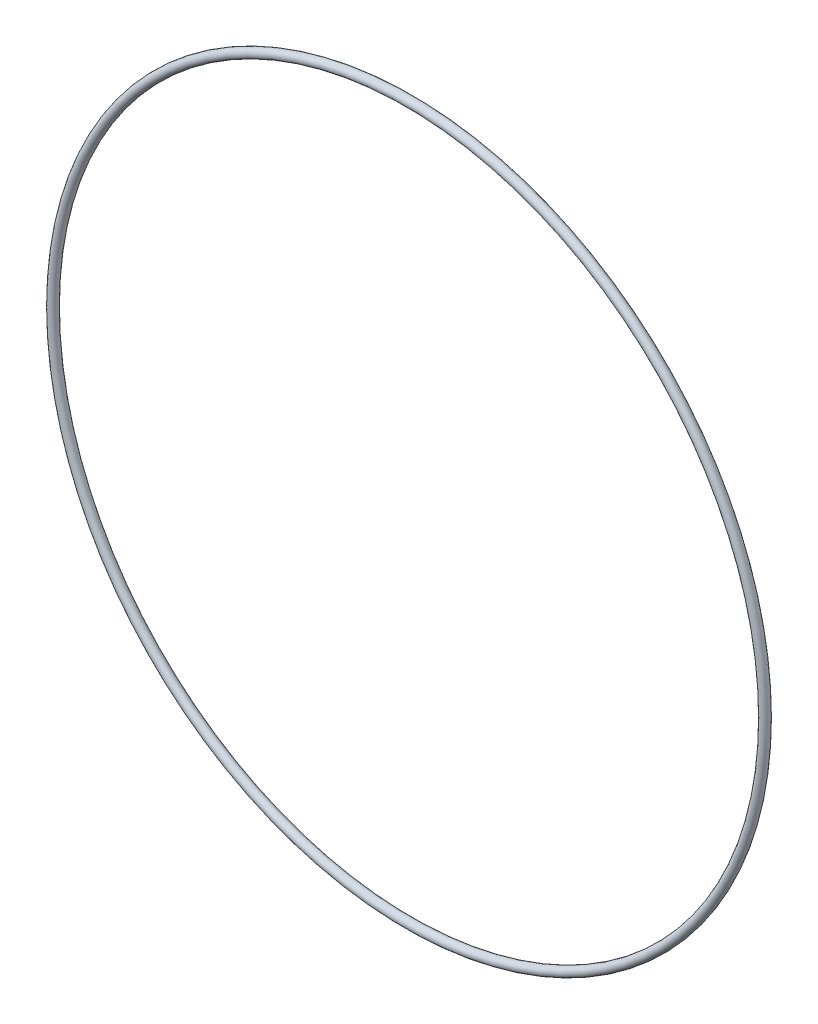
from build123d import *

# Parameters (mm, degrees)
SKETCH1_R   = 6
SKETCH1_R_2 = 5


with BuildPart() as part:
    # Sketch1 → Revolve1 (revolve)
    with BuildSketch(Plane(origin=(0, 0, 0), x_dir=(1, 0, 0), z_dir=(0, 1, 0))):
        Circle(SKETCH1_R)
        Circle(SKETCH1_R_2, mode=Mode.SUBTRACT)
    revolve(axis=Axis((470, 0, -23.804468453), (0, 0, 1)))


solid = part.part
